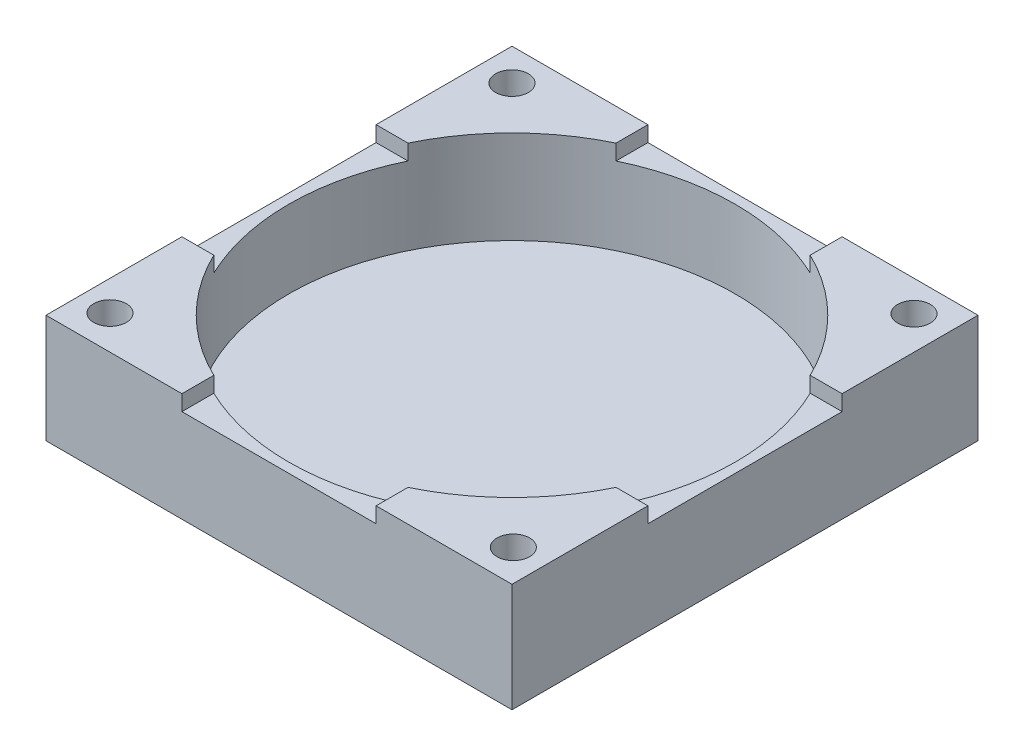
from build123d import *

# Parameters (mm, degrees)
SKETCH1_W           = 60
SKETCH1_H           = 60
SKETCH1_R           = 28.75
SKETCH1_R_2         = 2.1
BOSS_EXTRUDE4_DEPTH = 14
SKETCH1_8_R         = 28.75
BOSS_EXTRUDE5_DEPTH = 2
CUT_EXTRUDE2_START  = -2
CUT_EXTRUDE2_DEPTH  = 2


with BuildPart() as part:
    # Sketch1 → Boss-Extrude4 (new body)
    with BuildSketch(Plane(origin=(0, 0, 0), x_dir=(1, 0, 0), z_dir=(0, 1, 0))):
        Rectangle(SKETCH1_W, SKETCH1_H)
        Circle(SKETCH1_R, mode=Mode.SUBTRACT)
        with Locations((-25.880108191, 25.880108191)):
            Circle(SKETCH1_R_2, mode=Mode.SUBTRACT)
        with Locations((-26.120769668, -25.637187677)):
            Circle(SKETCH1_R_2, mode=Mode.SUBTRACT)
        with Locations((25.96435834, -25.795582877)):
            Circle(SKETCH1_R_2, mode=Mode.SUBTRACT)
        with Locations((25.713774072, 26.04538007)):
            Circle(SKETCH1_R_2, mode=Mode.SUBTRACT)
    extrude(amount=BOSS_EXTRUDE4_DEPTH)

    # Sketch1<8> → Boss-Extrude5 (add)
    with BuildSketch(Plane(origin=(0, 0, 0), x_dir=(1, 0, 0), z_dir=(0, 1, 0))):
        Circle(SKETCH1_8_R)
    extrude(amount=BOSS_EXTRUDE5_DEPTH)

    # Sketch5 → Cut-Extrude2 (cut)
    with BuildSketch(Plane(origin=(0, 14, 0), x_dir=(1, 0, 0), z_dir=(0, 1, 0)).offset(CUT_EXTRUDE2_START)):
        with BuildLine():
            Line((12.5, 30), (-12.5, 30))
            Line((-12.5, 30), (-12.5, 25.890393972))
            ThreePointArc((-12.5, 25.890393972), (0, 28.75), (12.5, 25.890393972))
            Line((12.5, 25.890393972), (12.5, 30))
        make_face()
        with BuildLine():
            ThreePointArc((-25.890393972, -12.5), (-28.75, 0), (-25.890393972, 12.5))
            Line((-25.890393972, 12.5), (-30, 12.5))
            Line((-30, 12.5), (-30, -12.5))
            Line((-30, -12.5), (-25.890393972, -12.5))
        make_face()
        with BuildLine():
            Line((30, 12.5), (25.890393972, 12.5))
            ThreePointArc((25.890393972, 12.5), (28.75, 0), (25.890393972, -12.5))
            Line((25.890393972, -12.5), (30, -12.5))
            Line((30, -12.5), (30, 12.5))
        make_face()
        with BuildLine():
            ThreePointArc((12.5, -25.890393972), (0, -28.75), (-12.5, -25.890393972))
            Line((-12.5, -25.890393972), (-12.5, -30))
            Line((-12.5, -30), (12.5, -30))
            Line((12.5, -30), (12.5, -25.890393972))
        make_face()
    extrude(amount=CUT_EXTRUDE2_DEPTH, mode=Mode.SUBTRACT)


solid = part.part
